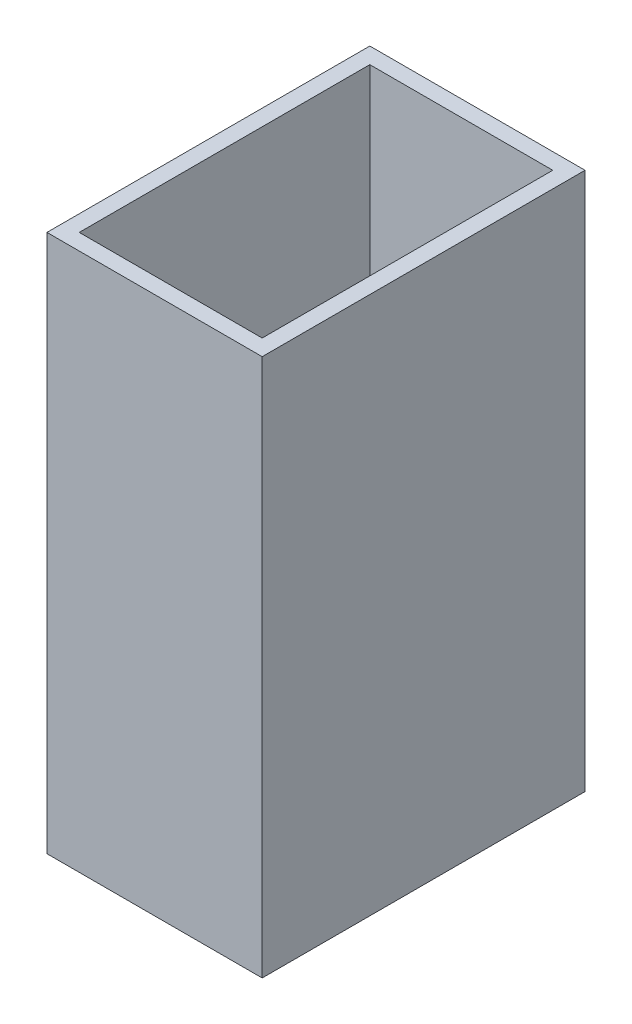
from build123d import *

# Parameters (mm, degrees)
SKETCH1_W               = 40
SKETCH1_H               = 60
BOSS_EXTRUDE1_DEPTH     = 100
CUT_EXTRUDE1_DEPTH      = 124.288280059
CUT_EXTRUDE1_DEPTH_BACK = 90
SKETCH2_W               = 34
SKETCH2_H               = 54
F_5_0_MM_DOWEL_HOLES1_D = 5


with BuildPart() as part:
    # Sketch1 → Boss-Extrude1 (new body)
    with BuildSketch(Plane(origin=(0, 0, 0), x_dir=(1, 0, 0), z_dir=(0, 1, 0))):
        with Locations((20, -30)):
            Rectangle(SKETCH1_W, SKETCH1_H)
    extrude(amount=BOSS_EXTRUDE1_DEPTH)

    # Sketch2 → Cut-Extrude1 (cut, two sides: drawn at the far end of the back side and taken through both)
    with BuildSketch(Plane(origin=(0, 100, 0), x_dir=(1, 0, 0), z_dir=(0, 1, 0)).offset(-CUT_EXTRUDE1_DEPTH_BACK)):
        with Locations((20, -30)):
            Rectangle(SKETCH2_W, SKETCH2_H)
    extrude(amount=CUT_EXTRUDE1_DEPTH + CUT_EXTRUDE1_DEPTH_BACK, mode=Mode.SUBTRACT)

    # Ø5.0 mm Dowel Holes1 (through all)
    with Locations(Plane(origin=(0, 10, 0), x_dir=(1, 0, 0), z_dir=(0, 1, 0))):
        with Locations((32.7, -12.22), (7.3, -12.22), (7.3, -47.78), (32.7, -47.78)):
            Hole(F_5_0_MM_DOWEL_HOLES1_D / 2)


solid = part.part
